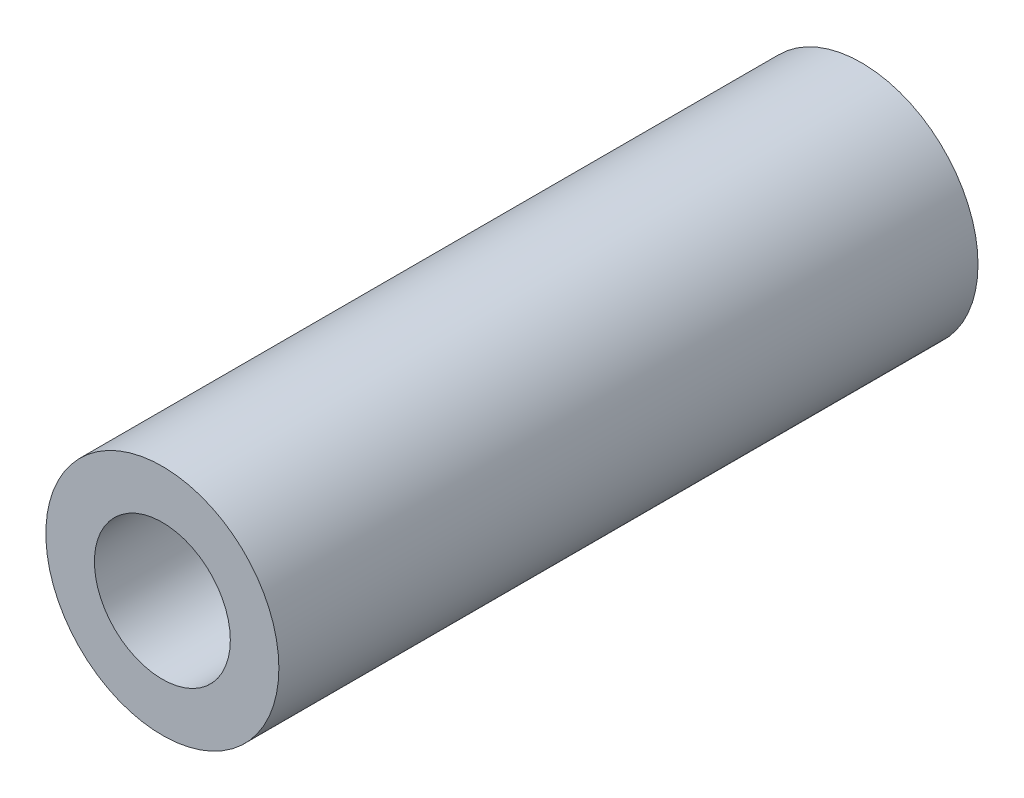
from build123d import *

# Parameters (mm, degrees)
SCHIZZO1_R                   = 3
SCHIZZO1_R_2                 = 1.75
ESTRUSIONE_ESTRUSIONE1_DEPTH = 18


with BuildPart() as part:
    # Schizzo1 → Estrusione-Estrusione1 (new body)
    with BuildSketch(Plane.XY):
        Circle(SCHIZZO1_R)
        Circle(SCHIZZO1_R_2, mode=Mode.SUBTRACT)
    extrude(amount=ESTRUSIONE_ESTRUSIONE1_DEPTH)


solid = part.part
